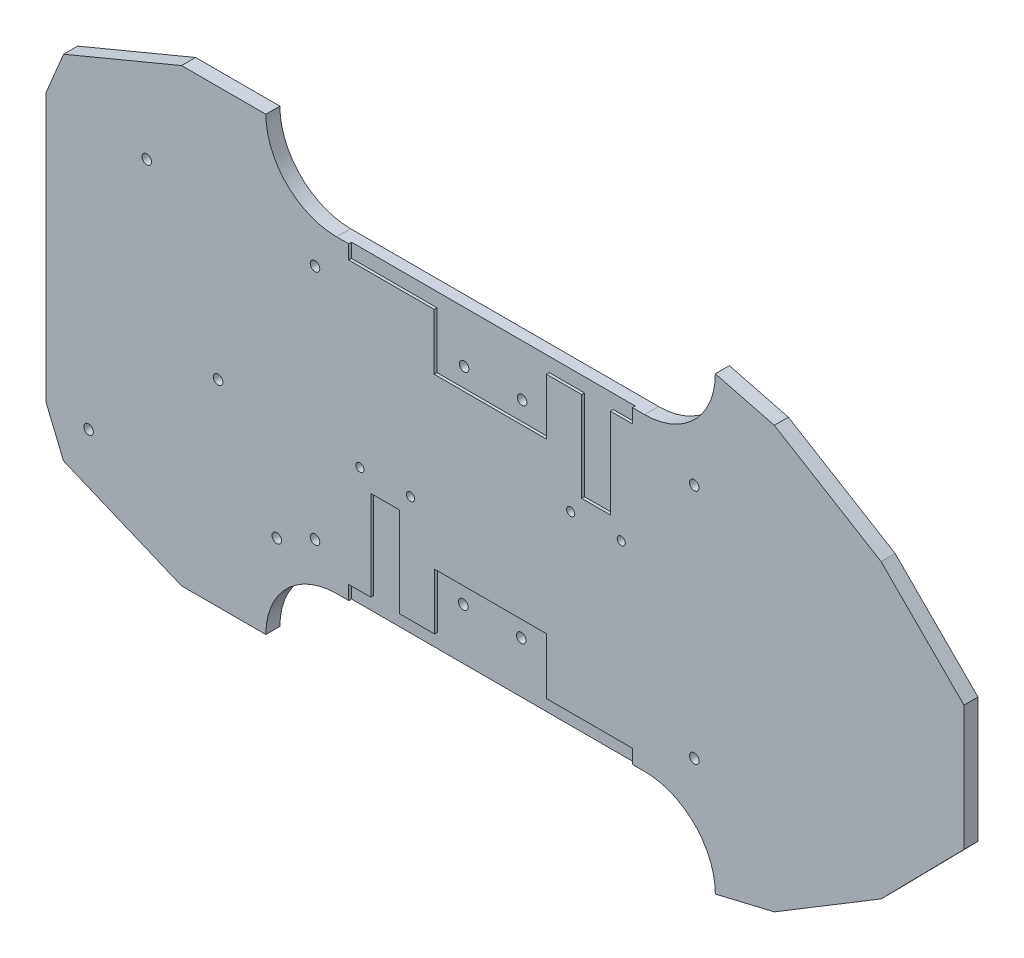
from build123d import *

# Parameters (mm, degrees)
BOSS_EXTRU_1_DEPTH      = 5
D_GAGEMENT_M2_51_D      = 2.9
D_GAGEMENT_M2_51_DEPTH  = 5
D_GAGEMENT_M2_51_TIP    = 0.871247898
D_GAGEMENT_M31_D        = 3.4
D_GAGEMENT_M31_DEPTH    = 6
D_GAGEMENT_M31_TIP      = 1.021463052
D_GAGEMENT_M32_D        = 3.4
D_GAGEMENT_M32_DEPTH    = 5
D_GAGEMENT_M32_TIP      = 1.021463052
ENL_V_MAT_EXTRU_1_DEPTH = 1
ENL_V_MAT_EXTRU_2_DEPTH = 1
D_GAGEMENT_M33_D        = 3.4
D_GAGEMENT_M33_DEPTH    = 6
D_GAGEMENT_M33_TIP      = 1.021463052
D_GAGEMENT_M34_D        = 3.4
D_GAGEMENT_M34_DEPTH    = 5
D_GAGEMENT_M34_TIP      = 1.021463052


with BuildPart() as part:
    # Esquisse1 → Boss.-Extru.1 (new body)
    with BuildSketch(Plane.XY):
        with BuildLine():
            Line((-87.472008168, 59.584338106), (-117.472008168, 59.584338106))
            Line((-117.472008168, 59.584338106), (-159.472008168, 42.084338106))
            Line((-159.472008168, 42.084338106), (-165.722008168, 27.084338106))
            Line((-165.722008168, 27.084338106), (-165.722008168, -68.315661894))
            Line((-165.722008168, -68.315661894), (-159.472008168, -83.315661894))
            Line((-159.472008168, -83.315661894), (-117.472008168, -100.815661894))
            Line((-117.472008168, -100.815661894), (-87.472008168, -100.815661894))
            ThreePointArc((-87.472008168, -100.815661894), (-80.091099054, -82.996571008), (-62.272008168, -75.615661894))
            Line((-62.272008168, -75.615661894), (47.327991832, -75.615661894))
            ThreePointArc((47.327991832, -75.615661894), (65.147082718, -82.996571008), (72.527991832, -100.815661894))
            Line((72.527991832, -100.815661894), (93.527991832, -95.815661894))
            Line((93.527991832, -95.815661894), (131.527991832, -72.815661894))
            Line((131.527991832, -72.815661894), (161.027991832, -42.815661894))
            Line((161.027991832, -42.815661894), (161.027991832, 1.684338106))
            Line((161.027991832, 1.684338106), (131.527991832, 31.184338106))
            Line((131.527991832, 31.184338106), (93.527991832, 54.184338106))
            Line((93.527991832, 54.184338106), (72.527991832, 59.584338106))
            ThreePointArc((72.527991832, 59.584338106), (65.147082718, 41.76524722), (47.327991832, 34.384338106))
            Line((47.327991832, 34.384338106), (-62.272008168, 34.384338106))
            ThreePointArc((-62.272008168, 34.384338106), (-80.091099054, 41.76524722), (-87.472008168, 59.584338106))
        make_face()
    extrude(amount=BOSS_EXTRU_1_DEPTH)

    # Dégagement M2.51
    with Locations(Plane(origin=(0, 0, 0), x_dir=(-1, 0, 0), z_dir=(0, 0, -1))):
        with Locations((-21.027991832, -8.66564946), (-39.027991832, -8.66564946), (35.972008168, -32.565674331), (53.972008168, -32.565674331)):
            Hole(D_GAGEMENT_M2_51_D / 2, depth=D_GAGEMENT_M2_51_DEPTH)
            with Locations((0, 0, -(D_GAGEMENT_M2_51_DEPTH + D_GAGEMENT_M2_51_TIP / 2))):  # 118° drill point
                Cone(0, D_GAGEMENT_M2_51_D / 2, D_GAGEMENT_M2_51_TIP, mode=Mode.SUBTRACT)

    # Dégagement M31
    with Locations(Plane(origin=(0, 0, 0), x_dir=(-1, 0, 0), z_dir=(0, 0, -1))):
        with Locations((17.896581687, 16.134338106), (-2.752565352, 16.134338106), (18.196581687, -57.365661894), (-2.452565352, -57.365661894)):
            Hole(D_GAGEMENT_M31_D / 2, depth=D_GAGEMENT_M31_DEPTH)
            with Locations((0, 0, -(D_GAGEMENT_M31_DEPTH + D_GAGEMENT_M31_TIP / 2))):  # 118° drill point
                Cone(0, D_GAGEMENT_M31_D / 2, D_GAGEMENT_M31_TIP, mode=Mode.SUBTRACT)

    # Dégagement M32
    with Locations(Plane(origin=(0, 0, 0), x_dir=(-1, 0, 0), z_dir=(0, 0, -1))):
        with Locations((69.972008168, -62.728910548), (69.972008168, 21.49758676), (-65.027991832, -62.728910548), (-65.027991832, 21.49758676)):
            Hole(D_GAGEMENT_M32_D / 2, depth=D_GAGEMENT_M32_DEPTH)
            with Locations((0, 0, -(D_GAGEMENT_M32_DEPTH + D_GAGEMENT_M32_TIP / 2))):  # 118° drill point
                Cone(0, D_GAGEMENT_M32_D / 2, D_GAGEMENT_M32_TIP, mode=Mode.SUBTRACT)

    # Esquisse10 → Enlèv. mat.-Extru.1 (cut)
    with BuildSketch(Plane.XY.offset(5)):
        Polygon((43.027991832, -75.615661894), (43.027991832, -70.615661894), (12.42027445, -70.615661894), (12.42027445, -50.615661894), (-27.372008168, -50.615661894), (-27.372008168, -70.615661894), (-36.072008168, -70.615661894), (-39.872008168, -70.615661894), (-39.872008168, -38.615661894), (-50.072008168, -38.615661894), (-50.072008168, -70.615661894), (-57.972008168, -70.615661894), (-57.972008168, -75.615661894), align=None)
    extrude(amount=-ENL_V_MAT_EXTRU_1_DEPTH, mode=Mode.SUBTRACT)

    # Esquisse10<3> → Enlèv. mat.-Extru.2 (cut)
    with BuildSketch(Plane.XY.offset(5)):
        Polygon((43.027991832, 29.384338106), (43.027991832, 34.384338106), (-57.972008168, 34.384338106), (-57.972008168, 29.384338106), (-27.572008168, 29.384338106), (-27.572008168, 9.384338106), (12.427991832, 9.384338106), (12.427991832, 29.384338106), (24.927991832, 29.384338106), (24.927991832, -2.615661894), (35.127991832, -2.615661894), (35.127991832, 29.384338106), align=None)
    extrude(amount=-ENL_V_MAT_EXTRU_2_DEPTH, mode=Mode.SUBTRACT)

    # Dégagement M33
    with Locations(Plane(origin=(0, 0, 0), x_dir=(-1, 0, 0), z_dir=(0, 0, -1))):
        with Locations((104.471408589, -30.715661894), (129.871408589, 24.484338106)):
            Hole(D_GAGEMENT_M33_D / 2, depth=D_GAGEMENT_M33_DEPTH)
            with Locations((0, 0, -(D_GAGEMENT_M33_DEPTH + D_GAGEMENT_M33_TIP / 2))):  # 118° drill point
                Cone(0, D_GAGEMENT_M33_D / 2, D_GAGEMENT_M33_TIP, mode=Mode.SUBTRACT)

    # Dégagement M34
    with Locations(Plane(origin=(0, 0, 0), x_dir=(-1, 0, 0), z_dir=(0, 0, -1))):
        with Locations((150.571408589, -69.115661894), (83.571408589, -69.115661894)):
            Hole(D_GAGEMENT_M34_D / 2, depth=D_GAGEMENT_M34_DEPTH)
            with Locations((0, 0, -(D_GAGEMENT_M34_DEPTH + D_GAGEMENT_M34_TIP / 2))):  # 118° drill point
                Cone(0, D_GAGEMENT_M34_D / 2, D_GAGEMENT_M34_TIP, mode=Mode.SUBTRACT)


solid = part.part
